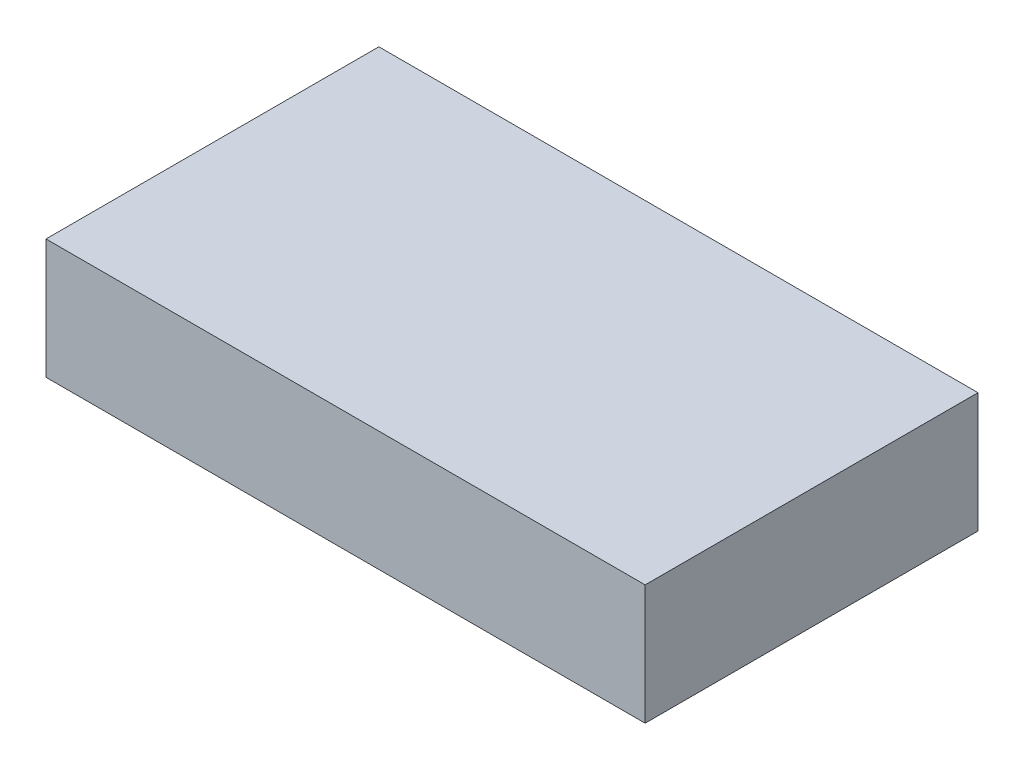
from build123d import *

# Parameters (mm, degrees)
SKETCH1_W           = 45
SKETCH1_H           = 25
BOSS_EXTRUDE1_DEPTH = 9


with BuildPart() as part:
    # Sketch1 → Boss-Extrude1 (new body)
    with BuildSketch(Plane(origin=(0, 0, 0), x_dir=(1, 0, 0), z_dir=(0, 1, 0))):
        Rectangle(SKETCH1_W, SKETCH1_H)
    extrude(amount=BOSS_EXTRUDE1_DEPTH)


solid = part.part
